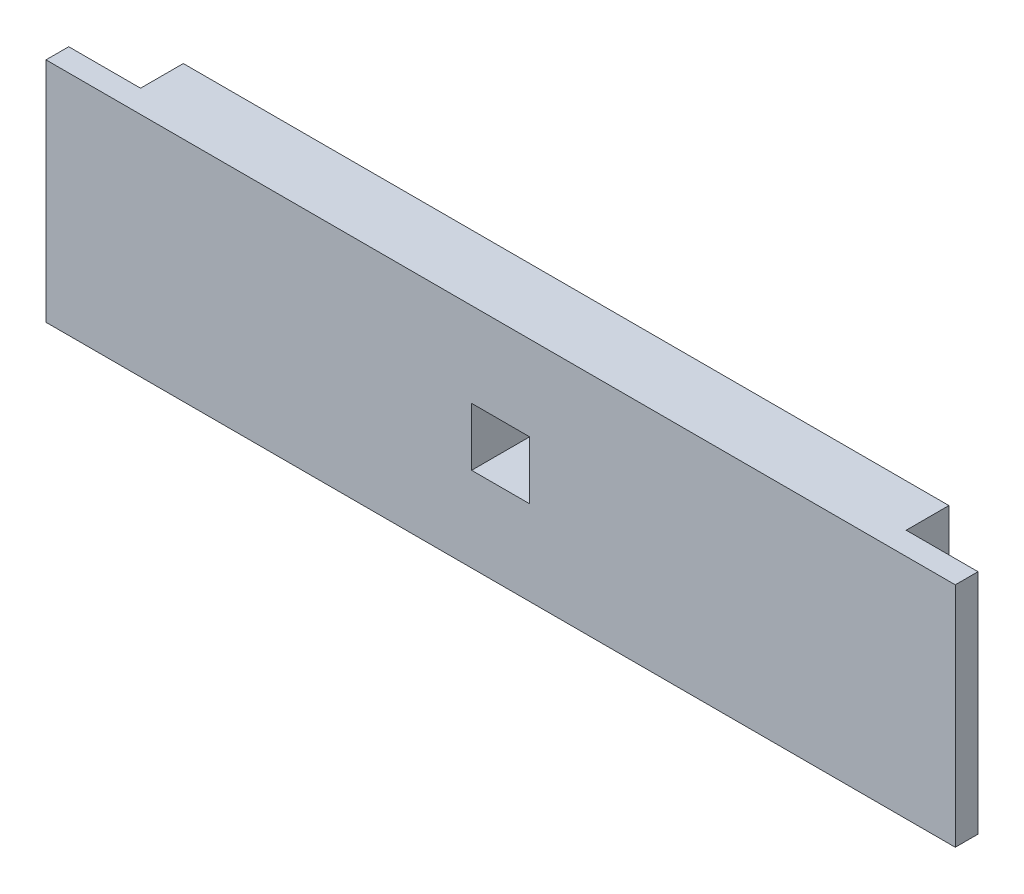
from build123d import *

# Parameters (mm, degrees)
SKETCH1_W           = 254
SKETCH1_H           = 63.5
BOSS_EXTRUDE1_DEPTH = 18.288
SKETCH2_W           = 16.2052
SKETCH2_H           = 16.2052
CUT_EXTRUDE1_DEPTH  = 263.455140822
SKETCH3_W           = 20.066
SKETCH3_H           = 63.5
CUT_EXTRUDE2_DEPTH  = 11.938


with BuildPart() as part:
    # Sketch1 → Boss-Extrude1 (new body)
    with BuildSketch(Plane.XY):
        with Locations((127, 31.75)):
            Rectangle(SKETCH1_W, SKETCH1_H)
    extrude(amount=BOSS_EXTRUDE1_DEPTH)

    # Sketch2 → Cut-Extrude1 (cut, through all)
    with BuildSketch(Plane.XY.offset(18.288)):
        with Locations((127, 31.75)):
            Rectangle(SKETCH2_W, SKETCH2_H)
    extrude(amount=-CUT_EXTRUDE1_DEPTH, mode=Mode.SUBTRACT)

    # Sketch3 → Cut-Extrude2 (cut)
    with BuildSketch(Plane(origin=(0, 0, 0), x_dir=(-1, 0, 0), z_dir=(0, 0, -1))):
        with Locations((-243.967, 31.75)):
            Rectangle(SKETCH3_W, SKETCH3_H)
        with Locations((-10.033, 31.75)):
            Rectangle(SKETCH3_W, SKETCH3_H)
    extrude(amount=-CUT_EXTRUDE2_DEPTH, mode=Mode.SUBTRACT)


solid = part.part
